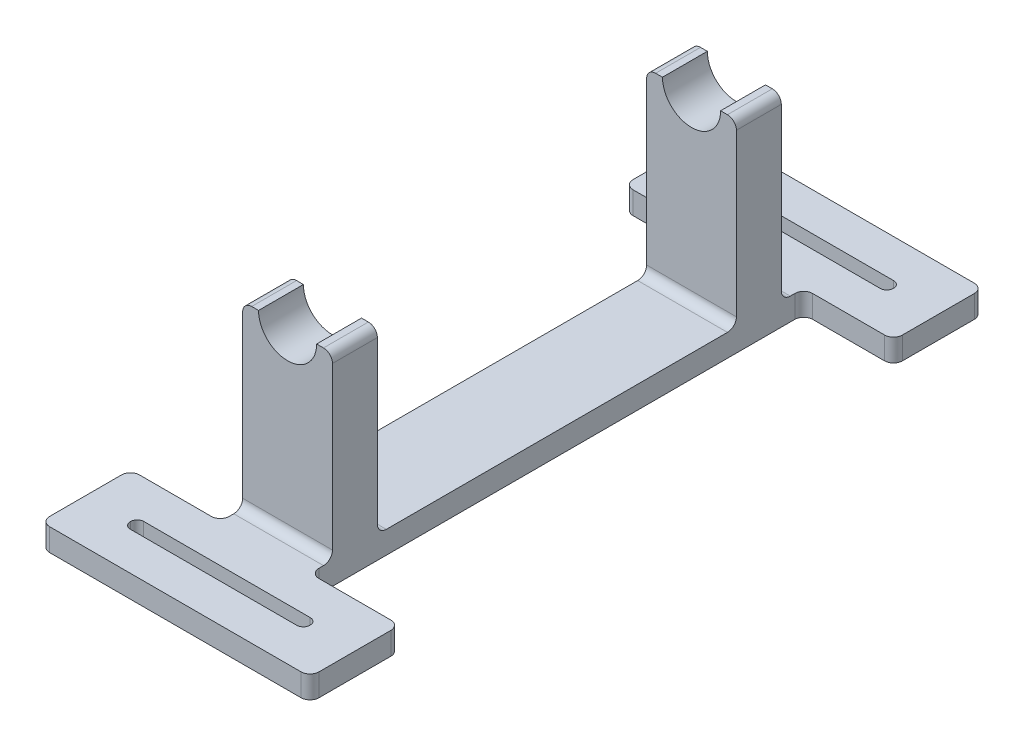
from build123d import *

# Parameters (mm, degrees)
BOSS_EXTRUDE1_DEPTH = 5
CUT_EXTRUDE1_DEPTH  = 124.722915669
SKETCH3_W           = 20
SKETCH3_H           = 10
BOSS_EXTRUDE2_DEPTH = 40
SKETCH4_R           = 6.475
CUT_EXTRUDE2_DEPTH  = 137.198467549
FILLET3_R           = 2


with BuildPart() as part:
    # Sketch1 → Boss-Extrude1 (new body)
    with BuildSketch(Plane(origin=(0, 0, 0), x_dir=(1, 0, 0), z_dir=(0, 1, 0))):
        Polygon((-29.999623956, -119.926382831), (30.000376044, -119.926382831), (30.000376044, -99.926382831), (10.000376044, -99.926382831), (10.000376044, 10.073617169), (30.000376044, 10.073617169), (30.000376044, 30.073617169), (-29.999623956, 30.073617169), (-29.999623956, 10.073617169), (-9.999623956, 10.073617169), (-9.999623956, -99.926382831), (-29.999623956, -99.926382831), align=None)
    extrude(amount=BOSS_EXTRUDE1_DEPTH)

    # Sketch2 → Cut-Extrude1 (cut, through all)
    with BuildSketch(Plane(origin=(0, 5, 0), x_dir=(1, 0, 0), z_dir=(0, 1, 0))):
        with BuildLine():
            Line((-18.549247911, 18.573617169), (18.55, 18.573617169))
            ThreePointArc((18.55, 18.573617169), (19.575304833, 18.998312337), (20, 20.023617169))
            Line((20, 20.023617169), (20, 20.123617169))
            ThreePointArc((20, 20.123617169), (19.575304833, 21.148922002), (18.55, 21.573617169))
            Line((18.55, 21.573617169), (-18.549247911, 21.573617169))
            ThreePointArc((-18.549247911, 21.573617169), (-19.574552744, 21.148922002), (-19.999247911, 20.123617169))
            Line((-19.999247911, 20.123617169), (-19.999247911, 20.023617169))
            ThreePointArc((-19.999247911, 20.023617169), (-19.574552744, 18.998312337), (-18.549247911, 18.573617169))
        make_face()
        with BuildLine():
            Line((-18.549623956, -111.426382831), (18.550376044, -111.426382831))
            ThreePointArc((18.550376044, -111.426382831), (19.575680877, -111.001687663), (20.000376044, -109.976382831))
            Line((20.000376044, -109.976382831), (20.000376044, -109.876382831))
            ThreePointArc((20.000376044, -109.876382831), (19.575680877, -108.851077998), (18.550376044, -108.426382831))
            Line((18.550376044, -108.426382831), (-18.549623956, -108.426382831))
            ThreePointArc((-18.549623956, -108.426382831), (-19.574928788, -108.851077998), (-19.999623956, -109.876382831))
            Line((-19.999623956, -109.876382831), (-19.999623956, -109.976382831))
            ThreePointArc((-19.999623956, -109.976382831), (-19.574928788, -111.001687663), (-18.549623956, -111.426382831))
        make_face()
    extrude(amount=-CUT_EXTRUDE1_DEPTH, mode=Mode.SUBTRACT)

    # Sketch3 → Boss-Extrude2 (add)
    with BuildSketch(Plane(origin=(0, 5, 0), x_dir=(1, 0, 0), z_dir=(0, 1, 0))):
        with Locations((0.000376044, 0.073617169)):
            Rectangle(SKETCH3_W, SKETCH3_H)
        with Locations((0.000376044, -89.926382831)):
            Rectangle(SKETCH3_W, SKETCH3_H)
    extrude(amount=BOSS_EXTRUDE2_DEPTH)

    # Sketch4 → Cut-Extrude2 (cut, through all)
    with BuildSketch(Plane(origin=(0, 0, -5.073617169), x_dir=(-1, 0, 0), z_dir=(0, 0, -1))):
        with Locations((-0.000376044, 45)):
            Circle(SKETCH4_R)
    extrude(amount=-CUT_EXTRUDE2_DEPTH, mode=Mode.SUBTRACT)

    # Fillet3
    fillet3_edges = [part.edges().sort_by_distance(p)[0] for p in [
        (-9.999623956, 45, 89.926382831),
        (10.000376044, 45, 89.926382831),
        (0.000376044, 5, 84.926382831),
        (0.000376044, 5, 94.926382831),
        (-29.999623956, 2.5, -10.073617169),
        (-29.999623956, 2.5, -30.073617169),
        (30.000376044, 2.5, -30.073617169),
        (30.000376044, 2.5, -10.073617169),
        (10.000376044, 2.5, -10.073617169),
        (10.000376044, 2.5, 99.926382831),
        (30.000376044, 2.5, 99.926382831),
        (30.000376044, 2.5, 119.926382831),
        (-29.999623956, 2.5, 119.926382831),
        (-29.999623956, 2.5, 99.926382831),
        (-9.999623956, 2.5, 99.926382831),
        (0.000376044, 5, -5.073617169),
        (0.000376044, 5, 4.926382831),
        (10.000376044, 45, -0.073617169),
        (-9.999623956, 45, -0.073617169),
    ]]
    fillet(fillet3_edges, radius=FILLET3_R)


solid = part.part
